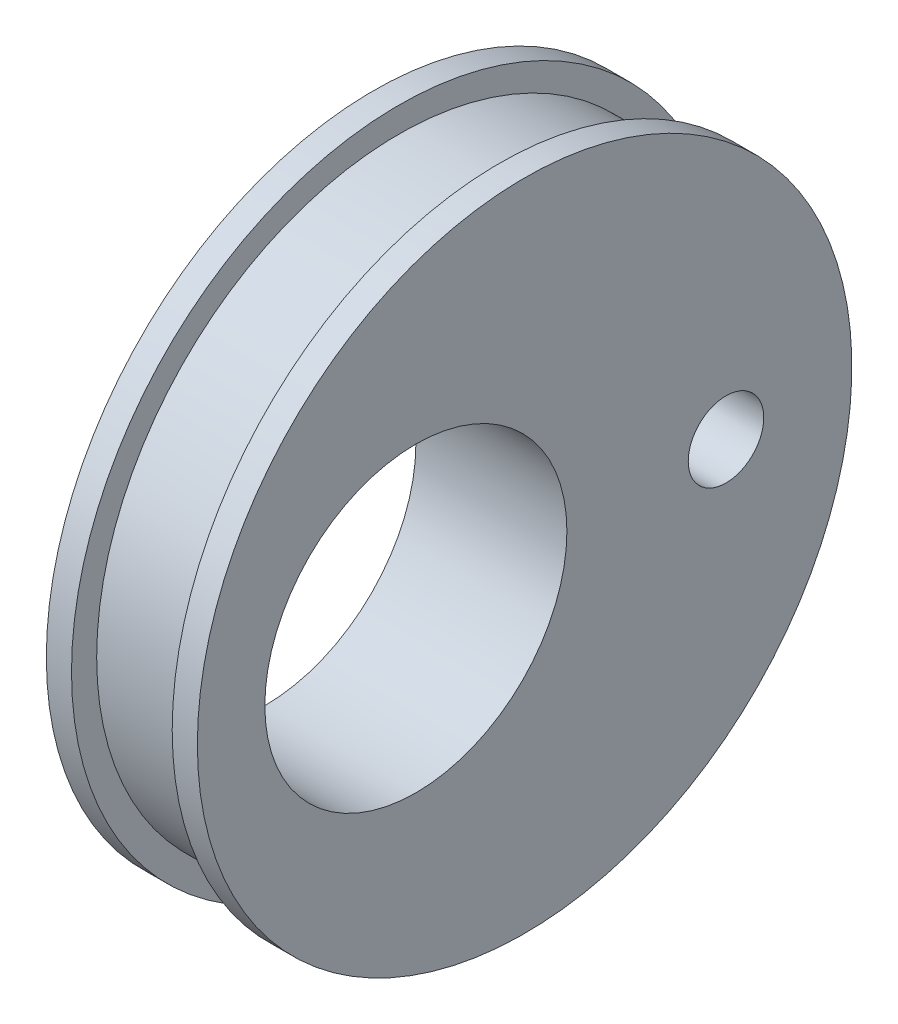
from build123d import *

# Parameters (mm, degrees)
SKETCH3_R          = 2.38125
SKETCH3_R_2        = 9.525
CUT_EXTRUDE1_DEPTH = 31.700788874


with BuildPart() as part:
    # Sketch2 → Revolve1 (revolve)
    with BuildSketch(Plane.XY, mode=Mode.PRIVATE) as revolve1_sk:
        Polygon((0, 0), (0, 19.05), (0, 20.6375), (1.5875, 20.6375), (1.5875, 19.05), (7.9375, 19.05), (7.9375, 20.6375), (9.525, 20.6375), (9.525, 19.05), (9.525, 0), align=None)
    revolve(revolve1_sk.sketch.rotate(Axis((0, 0, 0), (1, 0, 0)), 90), axis=Axis((0, 0, 0), (1, 0, 0)))

    # Sketch3 → Cut-Extrude1 (cut, through all)
    with BuildSketch(Plane.ZY):
        with Locations((-12.7, 0)):
            Circle(SKETCH3_R)
        with Locations((6.858, 0)):
            Circle(SKETCH3_R_2)
    extrude(amount=-CUT_EXTRUDE1_DEPTH, mode=Mode.SUBTRACT)


solid = part.part
